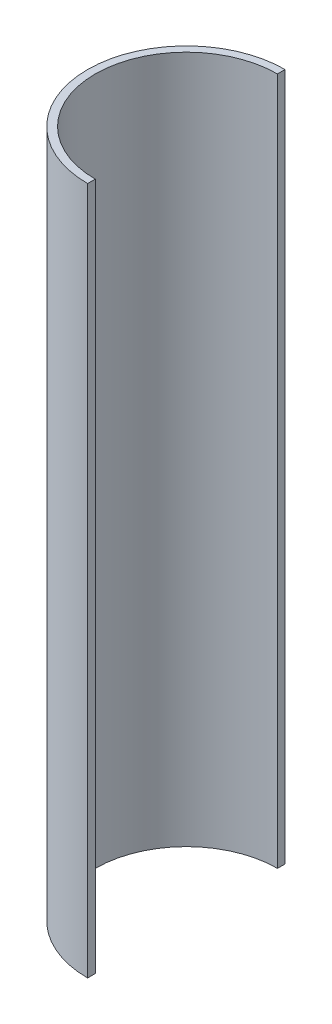
from build123d import *

# Parameters (mm, degrees)
SKETCH1_R           = 38.75
BOSS_EXTRUDE2_DEPTH = 270
CUT_EXTRUDE2_DEPTH  = 480
SKETCH4_W           = 38.75
SKETCH4_H           = 77.5
CUT_EXTRUDE3_DEPTH  = 480


with BuildPart() as part:
    # Sketch1 → Boss-Extrude2 (new body)
    with BuildSketch(Plane(origin=(0, 0, 0), x_dir=(1, 0, 0), z_dir=(0, 1, 0))):
        with Locations(Location((0, 0, 0), (0, 0, 270))):
            Circle(SKETCH1_R)
    extrude(amount=BOSS_EXTRUDE2_DEPTH)

    # Sketch3 → Cut-Extrude2 (cut)
    with BuildSketch(Plane(origin=(0, 270, 0), x_dir=(1, 0, 0), z_dir=(0, 1, 0))):
        with BuildLine():
            Line((0, -35.75), (0, 35.75))
            ThreePointArc((0, 35.75), (-35.75, 0), (0, -35.75))
        make_face()
    extrude(amount=-CUT_EXTRUDE2_DEPTH, mode=Mode.SUBTRACT)

    # Sketch4 → Cut-Extrude3 (cut)
    with BuildSketch(Plane(origin=(0, 270, 0), x_dir=(1, 0, 0), z_dir=(0, 1, 0))):
        with Locations((19.375, 0)):
            Rectangle(SKETCH4_W, SKETCH4_H)
    extrude(amount=-CUT_EXTRUDE3_DEPTH, mode=Mode.SUBTRACT)


solid = part.part
